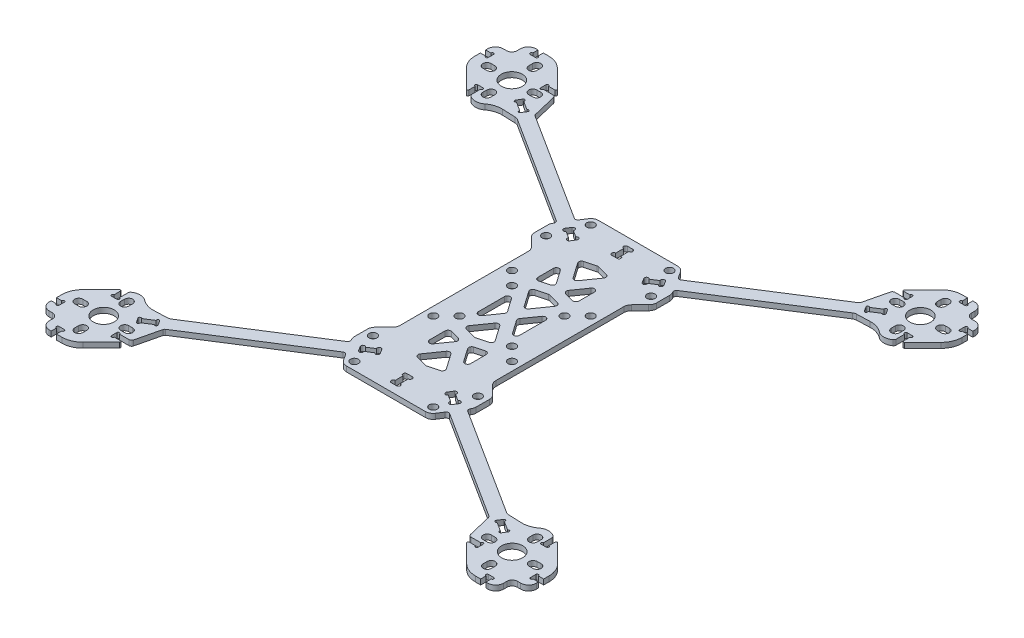
from build123d import *

# Parameters (mm, degrees)
SKETCH11_R               = 1.5
BOSS_EXTRUDE1_DEPTH      = 2
MIRROR11_COPY_1_SKETCH_R = 1.5
MIRROR11_COPY_1_DEPTH    = 2
FILLET1_R                = 1


with BuildPart() as part:
    # Sketch11 → Boss-Extrude1 (new body)
    with BuildSketch(Plane(origin=(0, 0, 0), x_dir=(1, 0, 0), z_dir=(0, 1, 0))):
        with BuildLine():
            Line((0, 48.049), (0, 45.049))
            Line((0, 45.049), (1, 45.049))
            ThreePointArc((1, 45.049), (1.75, 44.299), (1, 43.549))
            Line((1, 43.549), (1, 40.549))
            ThreePointArc((1, 40.549), (1.75, 39.799), (1, 39.049))
            Line((1, 39.049), (0, 39.049))
            Line((0, 39.049), (0, 32.80309693))
            ThreePointArc((0, 32.80309693), (0.143578811, 32.793686277), (0.28470095, 32.765615339))
            Line((0.28470095, 32.765615339), (4.345061591, 31.677644984))
            ThreePointArc((4.345061591, 31.677644984), (5.094022524, 30.991348733), (4.96142789, 29.984192495))
            Line((4.96142789, 29.984192495), (0.901067249, 24.185396539))
            ThreePointArc((0.901067249, 24.185396539), (0.507923475, 23.840618702), (0, 23.716330619))
            Line((0, 23.716330619), (0, 14.172763066))
            ThreePointArc((0, 14.172763066), (0.143578811, 14.163352413), (0.28470095, 14.135281475))
            Line((0.28470095, 14.135281475), (4.34193597, 13.048148628))
            ThreePointArc((4.34193597, 13.048148628), (5.090896903, 12.361852376), (4.958302269, 11.354696139))
            Line((4.958302269, 11.354696139), (0.901067249, 5.560364032))
            ThreePointArc((0.901067249, 5.560364032), (0.507923475, 5.215586196), (0, 5.091298112))
            Line((0, 5.091298112), (0, 0))
            Line((0, 0), (2.133608841, 0))
            ThreePointArc((2.133608841, 0), (2.184520195, 0.330776379), (2.332541592, 0.63093408))
            Line((2.332541592, 0.63093408), (5.833579283, 5.63093408))
            ThreePointArc((5.833579283, 5.63093408), (7.065422911, 6.049088646), (7.834646532, 5))
            Line((7.834646532, 5), (7.834646532, 0))
            Line((7.834646532, 0), (18.23, 0))
            Line((18.23, 0), (18.23, 24.405210912))
            ThreePointArc((18.23, 24.405210912), (18.458361402, 25.553261209), (19.108679656, 26.526531256))
            Line((19.108679656, 26.526531256), (22.351320344, 29.769171943))
            ThreePointArc((22.351320344, 29.769171943), (23.001638598, 30.742441989), (23.23, 31.890492286))
            Line((23.23, 31.890492286), (23.23, 36.890492286))
            ThreePointArc((23.23, 36.890492286), (23.110149563, 37.729979328), (22.760174337, 38.502391111))
            Line((22.760174337, 38.502391111), (22.203314953, 39.376485255))
            Line((22.203314953, 39.376485255), (63.843312373, 65.904089271))
            ThreePointArc((63.843312373, 65.904089271), (64.428832986, 66.176008072), (65.065124634, 66.285128013))
            Line((65.065124634, 66.285128013), (70.038070725, 66.471092981))
            ThreePointArc((70.038070725, 66.471092981), (72.763925274, 66.09968229), (75.202790117, 64.826824401))
            ThreePointArc((75.202790117, 64.826824401), (77.821232983, 63.924391098), (80.457158001, 64.774407694))
            ThreePointArc((80.457158001, 64.774407694), (80.757156117, 65.128634183), (80.864893755, 65.580151488))
            Line((80.864893755, 65.580151488), (80.864893755, 68.801044398))
            ThreePointArc((80.864893755, 68.801044398), (80.364893755, 69.301044398), (80.864893755, 69.801044398))
            Line((80.864893755, 69.801044398), (82.864893755, 69.801044398))
            ThreePointArc((82.864893755, 69.801044398), (83.364893755, 69.301044398), (82.864893755, 68.801044398))
            Line((82.864893755, 68.801044398), (82.864893755, 66.417844552))
            ThreePointArc((82.864893755, 66.417844552), (83.111820382, 66.048292739), (83.547736467, 66.135001839))
            Line((83.547736467, 66.135001839), (90.521748004, 73.109013376))
            ThreePointArc((90.521748004, 73.109013376), (92.255930015, 75.704400167), (92.864893755, 78.765867626))
            Line((92.864893755, 78.765867626), (92.864893755, 80.801400089))
            Line((92.864893755, 80.801400089), (90.864893755, 80.801400089))
            ThreePointArc((90.864893755, 80.801400089), (90.364893755, 80.301400089), (89.864893755, 80.801400089))
            Line((89.864893755, 80.801400089), (89.864893755, 82.801400089))
            ThreePointArc((89.864893755, 82.801400089), (90.364893755, 83.301400089), (90.864893755, 82.801400089))
            Line((90.864893755, 82.801400089), (92.864893755, 82.801400089))
            Line((92.864893755, 82.801400089), (92.864893755, 83.551400089))
            ThreePointArc((92.864893755, 83.551400089), (91.986214098, 85.672720433), (89.864893755, 86.551400089))
            Line((89.864893755, 86.551400089), (88.614893755, 86.551400089))
            ThreePointArc((88.614893755, 86.551400089), (87.200680192, 87.137186527), (86.614893755, 88.551400089))
            Line((86.614893755, 88.551400089), (86.614893755, 89.801400089))
            ThreePointArc((86.614893755, 89.801400089), (85.736214098, 91.922720433), (83.614893755, 92.801400089))
            Line((83.614893755, 92.801400089), (82.864893755, 92.801400089))
            Line((82.864893755, 92.801400089), (82.864893755, 90.801044398))
            ThreePointArc((82.864893755, 90.801044398), (83.364893755, 90.301044398), (82.864893755, 89.801044398))
            Line((82.864893755, 89.801044398), (80.864893755, 89.801044398))
            ThreePointArc((80.864893755, 89.801044398), (80.364893755, 90.301044398), (80.864893755, 90.801044398))
            Line((80.864893755, 90.801044398), (80.864893755, 92.801400089))
            Line((80.864893755, 92.801400089), (78.829716983, 92.801400089))
            ThreePointArc((78.829716983, 92.801400089), (75.768249524, 92.192436349), (73.172862733, 90.458254338))
            Line((73.172862733, 90.458254338), (66.198851196, 83.484242801))
            ThreePointArc((66.198851196, 83.484242801), (66.112142096, 83.048326716), (66.481693909, 82.801400089))
            Line((66.481693909, 82.801400089), (68.864893755, 82.801400089))
            ThreePointArc((68.864893755, 82.801400089), (69.364893755, 83.301400089), (69.864893755, 82.801400089))
            Line((69.864893755, 82.801400089), (69.864893755, 80.801400089))
            ThreePointArc((69.864893755, 80.801400089), (69.364893755, 80.301400089), (68.864893755, 80.801400089))
            Line((68.864893755, 80.801400089), (65.193420583, 80.801400089))
            ThreePointArc((65.193420583, 80.801400089), (64.574060037, 80.586506778), (64.220892367, 80.034185116))
            Line((64.220892367, 80.034185116), (62.066596253, 71.033976723))
            ThreePointArc((62.066596253, 71.033976723), (61.90838067, 70.686335238), (61.631367645, 70.423370304))
            Line((61.631367645, 70.423370304), (19.516816911, 43.593442484))
            Line((19.516816911, 43.593442484), (17.562631701, 46.660898825))
            ThreePointArc((17.562631701, 46.660898825), (16.47542367, 47.679180267), (15.032457363, 48.049))
            Line((15.032457363, 48.049), (0, 48.049))
        make_face()
        with Locations(Location((15.032457363, 45.049, 0), (0, 0, 270))):
            Circle(SKETCH11_R, mode=Mode.SUBTRACT)
        with Locations(Location((10, 10, 0), (0, 0, 270))):
            Circle(SKETCH11_R, mode=Mode.SUBTRACT)
        with Locations(Location((20, 33, 0), (0, 0, 270))):
            Circle(SKETCH11_R, mode=Mode.SUBTRACT)
        with Locations(Location((15, 15, 0), (0, 0, 270))):
            Circle(SKETCH11_R, mode=Mode.SUBTRACT)
        with BuildLine():
            Line((13.99733048, 38.298608253), (16.527504818, 39.910507078))
            ThreePointArc((16.527504818, 39.910507078), (16.757073696, 40.946025369), (17.792591987, 40.716456491))
            Line((17.792591987, 40.716456491), (18.867191203, 39.029673599))
            ThreePointArc((18.867191203, 39.029673599), (18.637622325, 37.994155308), (17.602104035, 38.223724186))
            Line((17.602104035, 38.223724186), (15.071929697, 36.611825361))
            ThreePointArc((15.071929697, 36.611825361), (14.842360819, 35.576307071), (13.806842528, 35.805875949))
            Line((13.806842528, 35.805875949), (12.732243312, 37.49265884))
            ThreePointArc((12.732243312, 37.49265884), (12.96181219, 38.528177131), (13.99733048, 38.298608253))
        make_face(mode=Mode.SUBTRACT)
        with BuildLine():
            Line((7.834646532, 17.686932285), (7.834646532, 23.625032507))
            ThreePointArc((7.834646532, 23.625032507), (7.065422911, 24.674121152), (5.833579283, 24.255966587))
            Line((5.833579283, 24.255966587), (2.332541592, 19.255966587))
            ThreePointArc((2.332541592, 19.255966587), (2.199946958, 18.248810349), (2.948907891, 17.562514098))
            Line((2.948907891, 17.562514098), (6.449945582, 16.624413876))
            ThreePointArc((6.449945582, 16.624413876), (7.404284104, 16.81424361), (7.834646532, 17.686932285))
        make_face(mode=Mode.SUBTRACT)
        with BuildLine():
            Line((79.414893755, 87.301044398), (79.414893755, 85.801044398))
            ThreePointArc((79.414893755, 85.801044398), (77.864893755, 84.251044398), (76.314893755, 85.801044398))
            Line((76.314893755, 85.801044398), (76.314893755, 87.301044398))
            ThreePointArc((76.314893755, 87.301044398), (77.864893755, 88.851044398), (79.414893755, 87.301044398))
        make_face(mode=Mode.SUBTRACT)
        with BuildLine():
            Line((85.864893755, 79.351044398), (87.364893755, 79.351044398))
            ThreePointArc((87.364893755, 79.351044398), (88.914893755, 77.801044398), (87.364893755, 76.251044398))
            Line((87.364893755, 76.251044398), (85.864893755, 76.251044398))
            ThreePointArc((85.864893755, 76.251044398), (84.314893755, 77.801044398), (85.864893755, 79.351044398))
        make_face(mode=Mode.SUBTRACT)
        with BuildLine():
            Line((79.414893755, 69.801044398), (79.414893755, 68.301044398))
            ThreePointArc((79.414893755, 68.301044398), (77.864893755, 66.751044398), (76.314893755, 68.301044398))
            Line((76.314893755, 68.301044398), (76.314893755, 69.801044398))
            ThreePointArc((76.314893755, 69.801044398), (77.864893755, 71.351044398), (79.414893755, 69.801044398))
        make_face(mode=Mode.SUBTRACT)
        with BuildLine():
            Line((69.864893755, 76.251044398), (68.364893755, 76.251044398))
            ThreePointArc((68.364893755, 76.251044398), (66.814893755, 77.801044398), (68.364893755, 79.351044398))
            Line((68.364893755, 79.351044398), (69.864893755, 79.351044398))
            ThreePointArc((69.864893755, 79.351044398), (71.414893755, 77.801044398), (69.864893755, 76.251044398))
        make_face(mode=Mode.SUBTRACT)
        with BuildLine():
            Line((64.465874598, 70.450616817), (65.540473815, 68.763833925))
            ThreePointArc((65.540473815, 68.763833925), (66.230819342, 68.610788006), (66.38386526, 69.301133533))
            Line((66.38386526, 69.301133533), (69.757431044, 71.450331967))
            ThreePointArc((69.757431044, 71.450331967), (70.447776571, 71.297286048), (70.600822489, 71.987631575))
            Line((70.600822489, 71.987631575), (69.526223273, 73.674414467))
            ThreePointArc((69.526223273, 73.674414467), (68.835877746, 73.827460385), (68.682831827, 73.137114858))
            Line((68.682831827, 73.137114858), (65.309266044, 70.987916425))
            ThreePointArc((65.309266044, 70.987916425), (64.618920517, 71.140962344), (64.465874598, 70.450616817))
        make_face(mode=Mode.SUBTRACT)
        with BuildLine():
            ThreePointArc((75.40066491, 74.650238755), (81.238459538, 79.950242831), (73.967865954, 76.899282611))
            ThreePointArc((73.967865954, 76.899282611), (74.491327972, 75.651845965), (75.40066491, 74.650238755))
        make_face(mode=Mode.SUBTRACT)
    boss_extrude1 = extrude(amount=BOSS_EXTRUDE1_DEPTH)

    # Mirror10: Boss-Extrude1 across plane
    add(boss_extrude1.mirror(Plane(origin=(0, 0, 0), x_dir=(0, 0, 1), z_dir=(1, 0, 0))))

    # Mirror11: Boss-Extrude1 across plane
    add(boss_extrude1.mirror(Plane.XY))

    # Mirror11 copy 1 sketch → Mirror11 copy 1 (add)
    with BuildSketch(Plane(origin=(0, 0, 0), x_dir=(-1, 0, 0), z_dir=(0, 1, 0))):
        with BuildLine():
            Line((0, 48.049), (0, 45.049))
            Line((0, 45.049), (1, 45.049))
            ThreePointArc((1, 45.049), (1.75, 44.299), (1, 43.549))
            Line((1, 43.549), (1, 40.549))
            ThreePointArc((1, 40.549), (1.75, 39.799), (1, 39.049))
            Line((1, 39.049), (0, 39.049))
            Line((0, 39.049), (0, 32.80309693))
            ThreePointArc((0, 32.80309693), (0.143578811, 32.793686277), (0.28470095, 32.765615339))
            Line((0.28470095, 32.765615339), (4.345061591, 31.677644984))
            ThreePointArc((4.345061591, 31.677644984), (5.094022524, 30.991348733), (4.96142789, 29.984192495))
            Line((4.96142789, 29.984192495), (0.901067249, 24.185396539))
            ThreePointArc((0.901067249, 24.185396539), (0.507923475, 23.840618702), (0, 23.716330619))
            Line((0, 23.716330619), (0, 14.172763066))
            ThreePointArc((0, 14.172763066), (0.143578811, 14.163352413), (0.28470095, 14.135281475))
            Line((0.28470095, 14.135281475), (4.34193597, 13.048148628))
            ThreePointArc((4.34193597, 13.048148628), (5.090896903, 12.361852376), (4.958302269, 11.354696139))
            Line((4.958302269, 11.354696139), (0.901067249, 5.560364032))
            ThreePointArc((0.901067249, 5.560364032), (0.507923475, 5.215586196), (0, 5.091298112))
            Line((0, 5.091298112), (0, 0))
            Line((0, 0), (2.133608841, 0))
            ThreePointArc((2.133608841, 0), (2.184520195, 0.330776379), (2.332541592, 0.63093408))
            Line((2.332541592, 0.63093408), (5.833579283, 5.63093408))
            ThreePointArc((5.833579283, 5.63093408), (7.065422911, 6.049088646), (7.834646532, 5))
            Line((7.834646532, 5), (7.834646532, 0))
            Line((7.834646532, 0), (18.23, 0))
            Line((18.23, 0), (18.23, 24.405210912))
            ThreePointArc((18.23, 24.405210912), (18.458361402, 25.553261209), (19.108679656, 26.526531256))
            Line((19.108679656, 26.526531256), (22.351320344, 29.769171943))
            ThreePointArc((22.351320344, 29.769171943), (23.001638598, 30.742441989), (23.23, 31.890492286))
            Line((23.23, 31.890492286), (23.23, 36.890492286))
            ThreePointArc((23.23, 36.890492286), (23.110149563, 37.729979328), (22.760174337, 38.502391111))
            Line((22.760174337, 38.502391111), (22.203314953, 39.376485255))
            Line((22.203314953, 39.376485255), (63.843312373, 65.904089271))
            ThreePointArc((63.843312373, 65.904089271), (64.428832986, 66.176008072), (65.065124634, 66.285128013))
            Line((65.065124634, 66.285128013), (70.038070725, 66.471092981))
            ThreePointArc((70.038070725, 66.471092981), (72.763925274, 66.09968229), (75.202790117, 64.826824401))
            ThreePointArc((75.202790117, 64.826824401), (77.821232983, 63.924391098), (80.457158001, 64.774407694))
            ThreePointArc((80.457158001, 64.774407694), (80.757156117, 65.128634183), (80.864893755, 65.580151488))
            Line((80.864893755, 65.580151488), (80.864893755, 68.801044398))
            ThreePointArc((80.864893755, 68.801044398), (80.364893755, 69.301044398), (80.864893755, 69.801044398))
            Line((80.864893755, 69.801044398), (82.864893755, 69.801044398))
            ThreePointArc((82.864893755, 69.801044398), (83.364893755, 69.301044398), (82.864893755, 68.801044398))
            Line((82.864893755, 68.801044398), (82.864893755, 66.417844552))
            ThreePointArc((82.864893755, 66.417844552), (83.111820382, 66.048292739), (83.547736467, 66.135001839))
            Line((83.547736467, 66.135001839), (90.521748004, 73.109013376))
            ThreePointArc((90.521748004, 73.109013376), (92.255930015, 75.704400167), (92.864893755, 78.765867626))
            Line((92.864893755, 78.765867626), (92.864893755, 80.801400089))
            Line((92.864893755, 80.801400089), (90.864893755, 80.801400089))
            ThreePointArc((90.864893755, 80.801400089), (90.364893755, 80.301400089), (89.864893755, 80.801400089))
            Line((89.864893755, 80.801400089), (89.864893755, 82.801400089))
            ThreePointArc((89.864893755, 82.801400089), (90.364893755, 83.301400089), (90.864893755, 82.801400089))
            Line((90.864893755, 82.801400089), (92.864893755, 82.801400089))
            Line((92.864893755, 82.801400089), (92.864893755, 83.551400089))
            ThreePointArc((92.864893755, 83.551400089), (91.986214098, 85.672720433), (89.864893755, 86.551400089))
            Line((89.864893755, 86.551400089), (88.614893755, 86.551400089))
            ThreePointArc((88.614893755, 86.551400089), (87.200680192, 87.137186527), (86.614893755, 88.551400089))
            Line((86.614893755, 88.551400089), (86.614893755, 89.801400089))
            ThreePointArc((86.614893755, 89.801400089), (85.736214098, 91.922720433), (83.614893755, 92.801400089))
            Line((83.614893755, 92.801400089), (82.864893755, 92.801400089))
            Line((82.864893755, 92.801400089), (82.864893755, 90.801044398))
            ThreePointArc((82.864893755, 90.801044398), (83.364893755, 90.301044398), (82.864893755, 89.801044398))
            Line((82.864893755, 89.801044398), (80.864893755, 89.801044398))
            ThreePointArc((80.864893755, 89.801044398), (80.364893755, 90.301044398), (80.864893755, 90.801044398))
            Line((80.864893755, 90.801044398), (80.864893755, 92.801400089))
            Line((80.864893755, 92.801400089), (78.829716983, 92.801400089))
            ThreePointArc((78.829716983, 92.801400089), (75.768249524, 92.192436349), (73.172862733, 90.458254338))
            Line((73.172862733, 90.458254338), (66.198851196, 83.484242801))
            ThreePointArc((66.198851196, 83.484242801), (66.112142096, 83.048326716), (66.481693909, 82.801400089))
            Line((66.481693909, 82.801400089), (68.864893755, 82.801400089))
            ThreePointArc((68.864893755, 82.801400089), (69.364893755, 83.301400089), (69.864893755, 82.801400089))
            Line((69.864893755, 82.801400089), (69.864893755, 80.801400089))
            ThreePointArc((69.864893755, 80.801400089), (69.364893755, 80.301400089), (68.864893755, 80.801400089))
            Line((68.864893755, 80.801400089), (65.193420583, 80.801400089))
            ThreePointArc((65.193420583, 80.801400089), (64.574060037, 80.586506778), (64.220892367, 80.034185116))
            Line((64.220892367, 80.034185116), (62.066596253, 71.033976723))
            ThreePointArc((62.066596253, 71.033976723), (61.90838067, 70.686335238), (61.631367645, 70.423370304))
            Line((61.631367645, 70.423370304), (19.516816911, 43.593442484))
            Line((19.516816911, 43.593442484), (17.562631701, 46.660898825))
            ThreePointArc((17.562631701, 46.660898825), (16.47542367, 47.679180267), (15.032457363, 48.049))
            Line((15.032457363, 48.049), (0, 48.049))
        make_face()
        with Locations(Location((15.032457363, 45.049, 0), (0, 0, 270))):
            Circle(MIRROR11_COPY_1_SKETCH_R, mode=Mode.SUBTRACT)
        with Locations(Location((10, 10, 0), (0, 0, 270))):
            Circle(MIRROR11_COPY_1_SKETCH_R, mode=Mode.SUBTRACT)
        with Locations(Location((20, 33, 0), (0, 0, 270))):
            Circle(MIRROR11_COPY_1_SKETCH_R, mode=Mode.SUBTRACT)
        with Locations(Location((15, 15, 0), (0, 0, 270))):
            Circle(MIRROR11_COPY_1_SKETCH_R, mode=Mode.SUBTRACT)
        with BuildLine():
            Line((13.99733048, 38.298608253), (16.527504818, 39.910507078))
            ThreePointArc((16.527504818, 39.910507078), (16.757073696, 40.946025369), (17.792591987, 40.716456491))
            Line((17.792591987, 40.716456491), (18.867191203, 39.029673599))
            ThreePointArc((18.867191203, 39.029673599), (18.637622325, 37.994155308), (17.602104035, 38.223724186))
            Line((17.602104035, 38.223724186), (15.071929697, 36.611825361))
            ThreePointArc((15.071929697, 36.611825361), (14.842360819, 35.576307071), (13.806842528, 35.805875949))
            Line((13.806842528, 35.805875949), (12.732243312, 37.49265884))
            ThreePointArc((12.732243312, 37.49265884), (12.96181219, 38.528177131), (13.99733048, 38.298608253))
        make_face(mode=Mode.SUBTRACT)
        with BuildLine():
            Line((7.834646532, 17.686932285), (7.834646532, 23.625032507))
            ThreePointArc((7.834646532, 23.625032507), (7.065422911, 24.674121152), (5.833579283, 24.255966587))
            Line((5.833579283, 24.255966587), (2.332541592, 19.255966587))
            ThreePointArc((2.332541592, 19.255966587), (2.199946958, 18.248810349), (2.948907891, 17.562514098))
            Line((2.948907891, 17.562514098), (6.449945582, 16.624413876))
            ThreePointArc((6.449945582, 16.624413876), (7.404284104, 16.81424361), (7.834646532, 17.686932285))
        make_face(mode=Mode.SUBTRACT)
        with BuildLine():
            Line((79.414893755, 87.301044398), (79.414893755, 85.801044398))
            ThreePointArc((79.414893755, 85.801044398), (77.864893755, 84.251044398), (76.314893755, 85.801044398))
            Line((76.314893755, 85.801044398), (76.314893755, 87.301044398))
            ThreePointArc((76.314893755, 87.301044398), (77.864893755, 88.851044398), (79.414893755, 87.301044398))
        make_face(mode=Mode.SUBTRACT)
        with BuildLine():
            Line((85.864893755, 79.351044398), (87.364893755, 79.351044398))
            ThreePointArc((87.364893755, 79.351044398), (88.914893755, 77.801044398), (87.364893755, 76.251044398))
            Line((87.364893755, 76.251044398), (85.864893755, 76.251044398))
            ThreePointArc((85.864893755, 76.251044398), (84.314893755, 77.801044398), (85.864893755, 79.351044398))
        make_face(mode=Mode.SUBTRACT)
        with BuildLine():
            Line((79.414893755, 69.801044398), (79.414893755, 68.301044398))
            ThreePointArc((79.414893755, 68.301044398), (77.864893755, 66.751044398), (76.314893755, 68.301044398))
            Line((76.314893755, 68.301044398), (76.314893755, 69.801044398))
            ThreePointArc((76.314893755, 69.801044398), (77.864893755, 71.351044398), (79.414893755, 69.801044398))
        make_face(mode=Mode.SUBTRACT)
        with BuildLine():
            Line((69.864893755, 76.251044398), (68.364893755, 76.251044398))
            ThreePointArc((68.364893755, 76.251044398), (66.814893755, 77.801044398), (68.364893755, 79.351044398))
            Line((68.364893755, 79.351044398), (69.864893755, 79.351044398))
            ThreePointArc((69.864893755, 79.351044398), (71.414893755, 77.801044398), (69.864893755, 76.251044398))
        make_face(mode=Mode.SUBTRACT)
        with BuildLine():
            Line((64.465874598, 70.450616817), (65.540473815, 68.763833925))
            ThreePointArc((65.540473815, 68.763833925), (66.230819342, 68.610788006), (66.38386526, 69.301133533))
            Line((66.38386526, 69.301133533), (69.757431044, 71.450331967))
            ThreePointArc((69.757431044, 71.450331967), (70.447776571, 71.297286048), (70.600822489, 71.987631575))
            Line((70.600822489, 71.987631575), (69.526223273, 73.674414467))
            ThreePointArc((69.526223273, 73.674414467), (68.835877746, 73.827460385), (68.682831827, 73.137114858))
            Line((68.682831827, 73.137114858), (65.309266044, 70.987916425))
            ThreePointArc((65.309266044, 70.987916425), (64.618920517, 71.140962344), (64.465874598, 70.450616817))
        make_face(mode=Mode.SUBTRACT)
        with BuildLine():
            ThreePointArc((75.40066491, 74.650238755), (81.238459538, 79.950242831), (73.967865954, 76.899282611))
            ThreePointArc((73.967865954, 76.899282611), (74.491327972, 75.651845965), (75.40066491, 74.650238755))
        make_face(mode=Mode.SUBTRACT)
    extrude(amount=MIRROR11_COPY_1_DEPTH)

    # Fillet1
    fillet1_edges = [part.edges().sort_by_distance(p)[0] for p in [
        (19.516816911, 1, -43.593442484),
        (22.203314953, 1, -39.376485255),
        (-19.516816911, 1, -43.593442484),
        (-22.203314953, 1, -39.376485255),
        (-22.203314953, 1, 39.376485255),
        (-19.516816911, 1, 43.593442484),
        (19.516816911, 1, 43.593442484),
        (22.203314953, 1, 39.376485255),
    ]]
    fillet(fillet1_edges, radius=FILLET1_R)


solid = part.part
